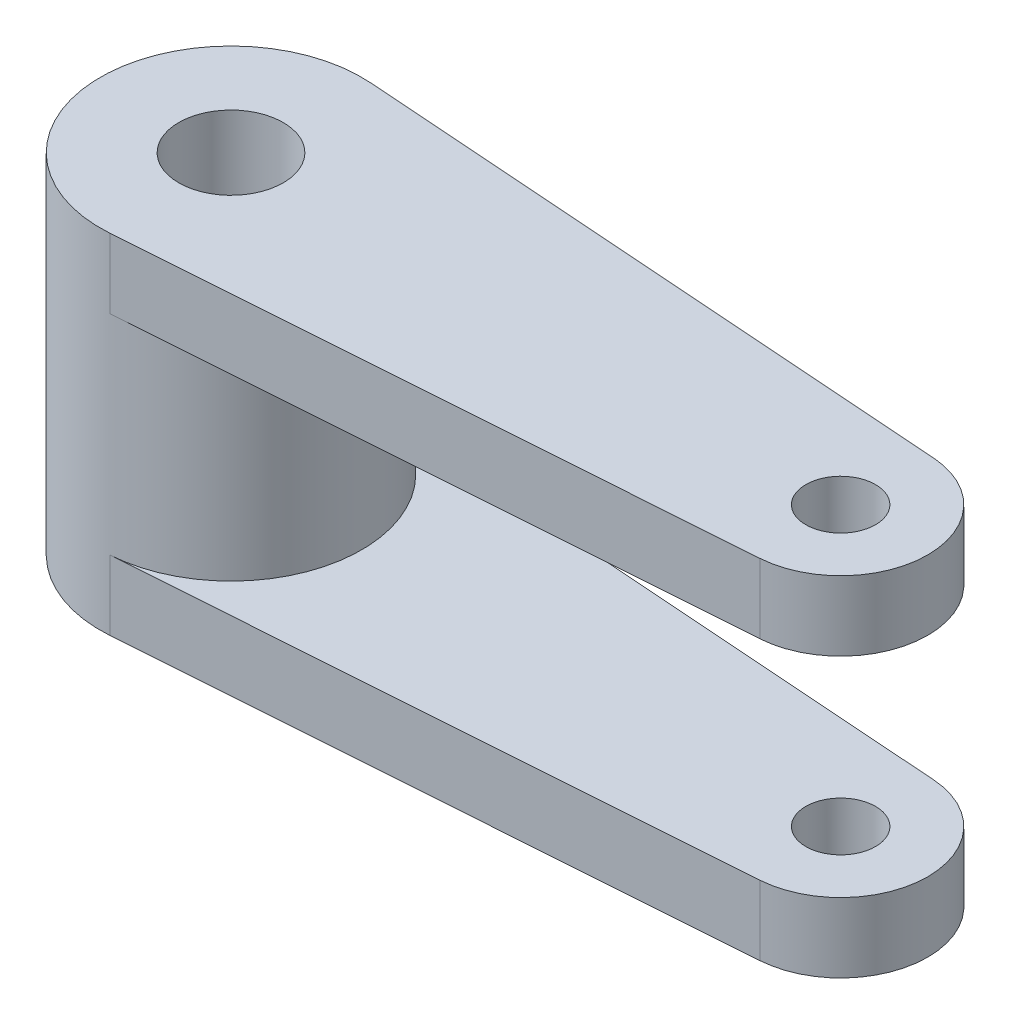
from build123d import *

# Parameters (mm, degrees)
SKETCH_1_R          = 15
EXTRUDE_1_DEPTH     = 40
EXTRUDE_2_DEPTH     = 8
SKETCH_3_R          = 6
CUT_EXTRUDE_1_DEPTH = 96
SKETCH_4_R          = 4
CUT_EXTRUDE_2_DEPTH = 96


with BuildPart() as part:
    # 草图1 → 凸台-拉伸1 (new body)
    with BuildSketch(Plane(origin=(0, -20, 0), x_dir=(1, 0, 0), z_dir=(0, 1, 0))):
        with Locations(Location((0, 0, 0), (0, 0, 270))):
            Circle(SKETCH_1_R)
    extrude(amount=EXTRUDE_1_DEPTH)

    # 草图2 → 凸台-拉伸2 (add)
    with BuildSketch(Plane(origin=(0, -20, 0), x_dir=(1, 0, 0), z_dir=(0, 1, 0))):
        with BuildLine():
            Line((1.071428571, 14.961685761), (70.714285714, 9.974457174))
            ThreePointArc((70.714285714, 9.974457174), (80, 0), (70.714285714, -9.974457174))
            Line((70.714285714, -9.974457174), (1.071428571, -14.961685761))
            ThreePointArc((1.071428571, -14.961685761), (-15, 0), (1.071428571, 14.961685761))
        make_face()
    extrude_2 = extrude(amount=EXTRUDE_2_DEPTH)

    # 镜向1: 凸台-拉伸2 across plane
    add(extrude_2.mirror(Plane.ZX))

    # 草图3 → 切除-拉伸1 (cut, symmetric)
    with BuildSketch(Plane(origin=(0, 0, 0), x_dir=(1, 0, 0), z_dir=(0, 1, 0))):
        with Locations(Location((0, 0, 0), (0, 0, 270))):
            Circle(SKETCH_3_R)
    extrude(amount=CUT_EXTRUDE_1_DEPTH, both=True, mode=Mode.SUBTRACT)

    # 草图4 → 切除-拉伸2 (cut, symmetric)
    with BuildSketch(Plane(origin=(0, 0, 0), x_dir=(1, 0, 0), z_dir=(0, 1, 0))):
        with Locations(Location((70, 0, 0), (0, 0, 270))):
            Circle(SKETCH_4_R)
    extrude(amount=CUT_EXTRUDE_2_DEPTH, both=True, mode=Mode.SUBTRACT)


solid = part.part
